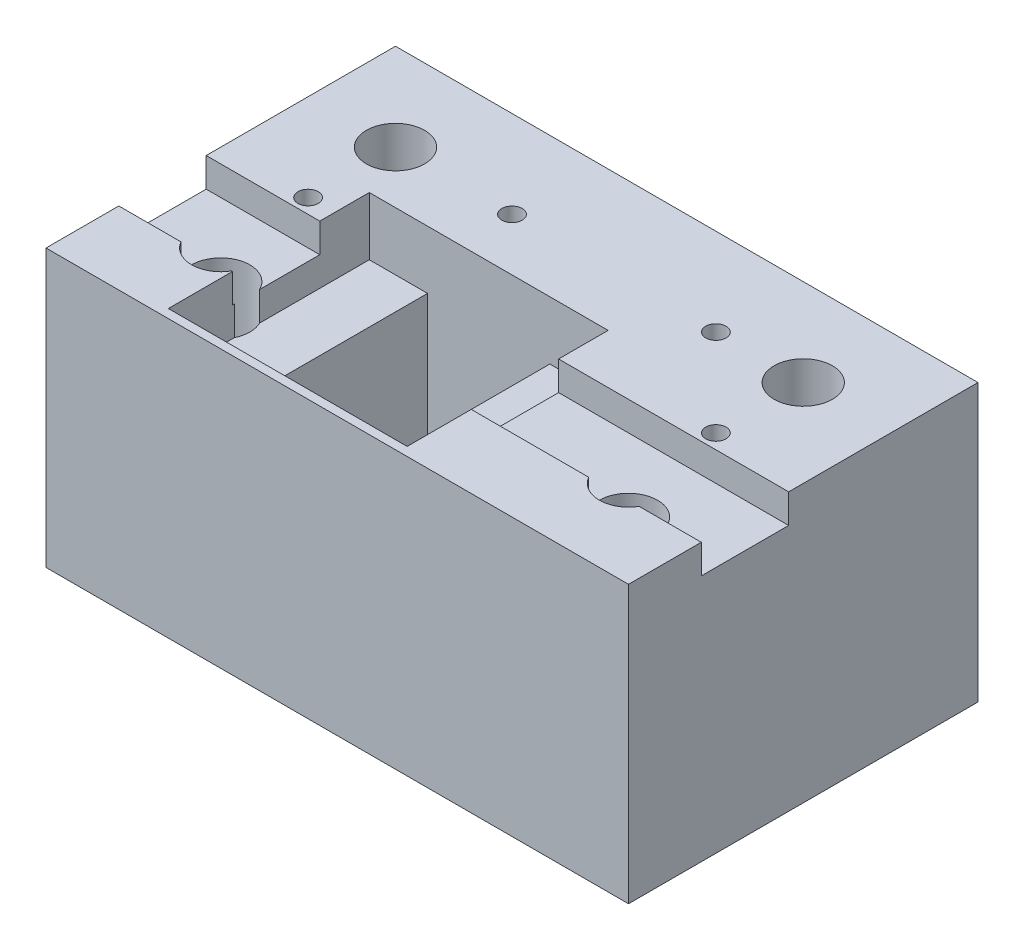
from build123d import *

# Parameters (mm, degrees)
SKETCH_1_W          = 20
SKETCH_1_H          = 12
SKETCH_1_W_2        = 4.2
SKETCH_1_H_2        = 6.9
EXTRUDE_1_DEPTH     = 9.5
CUT_EXTRUDE_START   = 9.5
SKETCH_1_4_W        = 20
SKETCH_1_4_H        = 3
CUT_EXTRUDE_2_DEPTH = 1
SKETCH_1_6_W        = 8.2
SKETCH_1_6_H        = 6.9
CUT_EXTRUDE_4_DEPTH = 2
SKETCH_2_R          = 0.7
SKETCH_2_R_2        = 0.35
CUT_EXTRUDE_5_DEPTH = 26.184320519
SKETCH_2_3_R        = 1
CUT_EXTRUDE_6_DEPTH = 7.5


with BuildPart() as part:
    # 草图1 → 凸台-拉伸1 (new body)
    with BuildSketch(Plane(origin=(0, 0, 0), x_dir=(1, 0, 0), z_dir=(0, 1, 0))):
        with Locations((10, -6)):
            Rectangle(SKETCH_1_W, SKETCH_1_H)
        with Locations((8, -8.25)):
            Rectangle(SKETCH_1_W_2, SKETCH_1_H_2, mode=Mode.SUBTRACT)
    extrude(amount=EXTRUDE_1_DEPTH)

    # 草图1<4> → 切除-拉伸2 (cut)
    with BuildSketch(Plane(origin=(0, 0, 0), x_dir=(1, 0, 0), z_dir=(0, 1, 0)).offset(CUT_EXTRUDE_START)):
        with Locations((10, -8)):
            Rectangle(SKETCH_1_4_W, SKETCH_1_4_H)
    extrude(amount=-CUT_EXTRUDE_2_DEPTH, mode=Mode.SUBTRACT)

    # 草图1<6> → 切除-拉伸4 (cut)
    with BuildSketch(Plane(origin=(0, 0, 0), x_dir=(1, 0, 0), z_dir=(0, 1, 0)).offset(CUT_EXTRUDE_START)):
        with Locations((8, -8.25)):
            Rectangle(SKETCH_1_6_W, SKETCH_1_6_H)
    extrude(amount=-CUT_EXTRUDE_4_DEPTH, mode=Mode.SUBTRACT)

    # 草图2 → 切除-拉伸5 (cut, through all)
    with BuildSketch(Plane(origin=(0, 9.5, 0), x_dir=(1, 0, 0), z_dir=(0, 1, 0))):
        with Locations(Location((3, -3, 0), (0, 0, 270))):
            Circle(SKETCH_2_R)
        with Locations(Location((3, -9, 0), (0, 0, 270))):
            Circle(SKETCH_2_R)
        with Locations(Location((17, -3, 0), (0, 0, 270))):
            Circle(SKETCH_2_R)
        with Locations(Location((17, -9, 0), (0, 0, 270))):
            Circle(SKETCH_2_R)
        with Locations(Location((7, -3, 0), (0, 0, 270))):
            Circle(SKETCH_2_R_2)
        with Locations(Location((14, -3, 0), (0, 0, 270))):
            Circle(SKETCH_2_R_2)
        with Locations(Location((3, -6, 0), (0, 0, 270))):
            Circle(SKETCH_2_R_2)
        with Locations(Location((17, -6, 0), (0, 0, 270))):
            Circle(SKETCH_2_R_2)
    extrude(amount=-CUT_EXTRUDE_5_DEPTH, mode=Mode.SUBTRACT)

    # 草图2<3> → 切除-拉伸6 (cut)
    with BuildSketch(Plane(origin=(0, 9.5, 0), x_dir=(1, 0, 0), z_dir=(0, 1, 0))):
        with Locations(Location((3, -3, 0), (0, 0, 270))):
            Circle(SKETCH_2_3_R)
        with Locations(Location((3, -9, 0), (0, 0, 330))):
            Circle(SKETCH_2_3_R)
        with Locations(Location((17, -3, 0), (0, 0, 270))):
            Circle(SKETCH_2_3_R)
        with Locations(Location((17, -9, 0), (0, 0, 330))):
            Circle(SKETCH_2_3_R)
    extrude(amount=-CUT_EXTRUDE_6_DEPTH, mode=Mode.SUBTRACT)


solid = part.part
